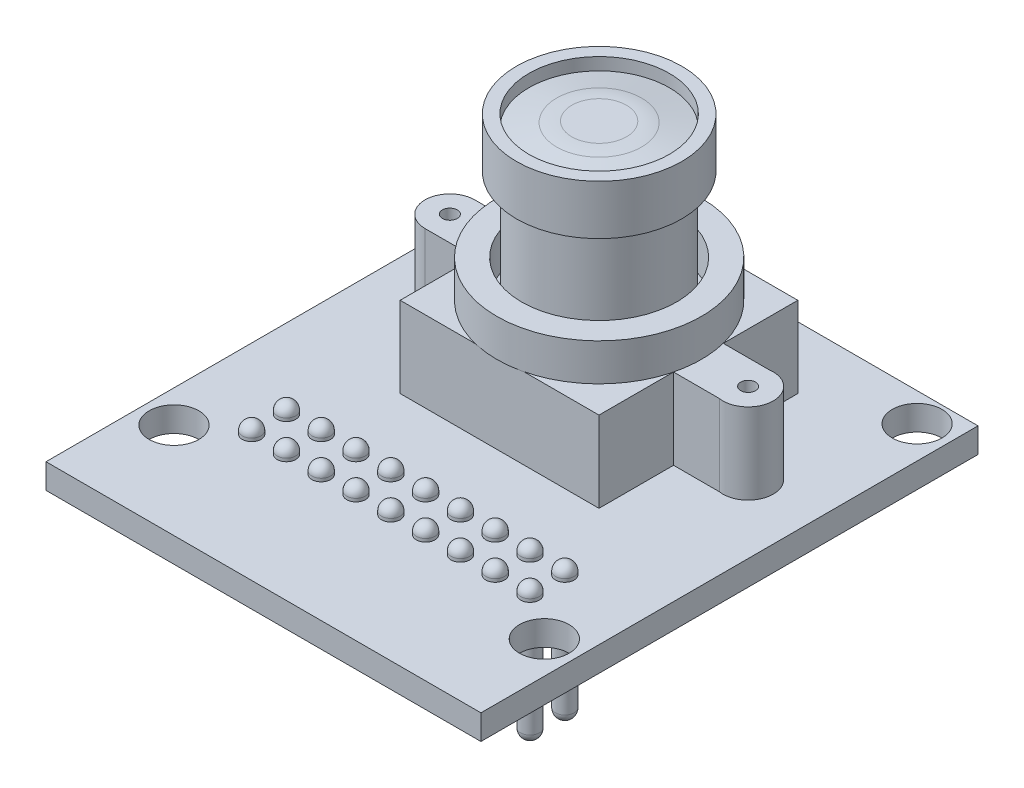
from build123d import *

# Parameters (mm, degrees)
BOARD_W                  = 35
BOARD_H                  = 40
BASEBOARD_DEPTH          = 2
SKETCH2_R                = 2
SCREW_HOLES_DEPTH        = 2
PINS_DEPTH               = 1
PINS_DEPTH_BACK          = 10
SKETCH3_R                = 0.75
FILLET1_R                = 0.75
SKETCH4_R                = 0.6
BOSS_EXTRUDE3_DEPTH      = 6.5
SKETCH5_R                = 8.234207434
SKETCH5_R_2              = 6.234207434
BOSS_EXTRUDE4_DEPTH      = 3
BOSS_EXTRUDE5_DEPTH      = 6
BOSS_EXTRUDE5_DEPTH_BACK = 3
SKETCH6_R                = 5.604867307
SKETCH6_R_2              = 4.804867307
SKETCH7_R                = 6.65
SKETCH7_R_2              = 5.65
BOSS_EXTRUDE6_DEPTH      = 4
SKETCH9_R                = 5.65
GLASS_DEPTH              = 0.5
GLASS_TAPER              = 80
FILLET2_R                = 7


with BuildPart() as part:
    # Board → BaseBoard (new body)
    with BuildSketch(Plane(origin=(0, 0, 0), x_dir=(1, 0, 0), z_dir=(0, 1, 0))):
        Rectangle(BOARD_W, BOARD_H)
    extrude(amount=BASEBOARD_DEPTH)

    # Sketch2 → Screw Holes (cut)
    with BuildSketch(Plane(origin=(0, 2, 0), x_dir=(1, 0, 0), z_dir=(0, 1, 0))):
        with Locations(Location((14.9, 17.7, 0), (0, 0, 270))):
            Circle(SKETCH2_R)
        with Locations(Location((14.9, -12.3, 0), (0, 0, 270))):
            Circle(SKETCH2_R)
        with Locations(Location((-14.9, -12.3, 0), (0, 0, 90))):
            Circle(SKETCH2_R)
        with Locations(Location((-14.9, 17.7, 0), (0, 0, 90))):
            Circle(SKETCH2_R)
    extrude(amount=-SCREW_HOLES_DEPTH, mode=Mode.SUBTRACT)

    # Sketch3 → Pins (add, two sides: drawn at the far end of the back side and taken through both)
    with BuildSketch(Plane(origin=(0, 2, 0), x_dir=(1, 0, 0), z_dir=(0, 1, 0)).offset(-PINS_DEPTH_BACK)):
        with Locations(Location((-11.15, -7, 0), (0, 0, 270))):
            Circle(SKETCH3_R)
        with Locations(Location((-8.35, -7, 0), (0, 0, 270))):
            Circle(SKETCH3_R)
        with Locations(Location((-5.55, -7, 0), (0, 0, 270))):
            Circle(SKETCH3_R)
        with Locations(Location((-2.75, -7, 0), (0, 0, 270))):
            Circle(SKETCH3_R)
        with Locations(Location((0.05, -7, 0), (0, 0, 270))):
            Circle(SKETCH3_R)
        with Locations(Location((2.85, -7, 0), (0, 0, 270))):
            Circle(SKETCH3_R)
        with Locations(Location((5.65, -7, 0), (0, 0, 270))):
            Circle(SKETCH3_R)
        with Locations(Location((8.45, -7, 0), (0, 0, 270))):
            Circle(SKETCH3_R)
        with Locations(Location((11.25, -7, 0), (0, 0, 270))):
            Circle(SKETCH3_R)
        with Locations(Location((-8.35, -9.8, 0), (0, 0, 270))):
            Circle(SKETCH3_R)
        with Locations(Location((-5.55, -9.8, 0), (0, 0, 270))):
            Circle(SKETCH3_R)
        with Locations(Location((-2.75, -9.8, 0), (0, 0, 270))):
            Circle(SKETCH3_R)
        with Locations(Location((0.05, -9.8, 0), (0, 0, 270))):
            Circle(SKETCH3_R)
        with Locations(Location((2.85, -9.8, 0), (0, 0, 270))):
            Circle(SKETCH3_R)
        with Locations(Location((5.65, -9.8, 0), (0, 0, 270))):
            Circle(SKETCH3_R)
        with Locations(Location((8.45, -9.8, 0), (0, 0, 270))):
            Circle(SKETCH3_R)
        with Locations(Location((11.25, -9.8, 0), (0, 0, 270))):
            Circle(SKETCH3_R)
        with Locations(Location((-11.15, -9.8, 0), (0, 0, 270))):
            Circle(SKETCH3_R)
    extrude(amount=PINS_DEPTH + PINS_DEPTH_BACK)

    # Fillet1
    fillet1_edges = [part.edges().sort_by_distance(p)[0] for p in [
        (2.85, -8, 9.05),
        (2.85, 3, 9.05),
        (5.65, -8, 9.05),
        (5.65, 3, 9.05),
        (8.45, -8, 9.05),
        (8.45, 3, 9.05),
        (11.25, -8, 9.05),
        (11.25, 3, 9.05),
        (-11.15, -8, 9.05),
        (-11.15, 3, 9.05),
        (-11.15, -8, 6.25),
        (-11.15, 3, 6.25),
        (-8.35, -8, 6.25),
        (-8.35, 3, 6.25),
        (-5.55, -8, 6.25),
        (-5.55, 3, 6.25),
        (-2.75, -8, 6.25),
        (-2.75, 3, 6.25),
        (0.05, -8, 6.25),
        (0.05, 3, 6.25),
        (2.85, -8, 6.25),
        (2.85, 3, 6.25),
        (5.65, -8, 6.25),
        (5.65, 3, 6.25),
        (8.45, -8, 6.25),
        (8.45, 3, 6.25),
        (11.25, -8, 6.25),
        (11.25, 3, 6.25),
        (-8.35, -8, 9.05),
        (-8.35, 3, 9.05),
        (-5.55, -8, 9.05),
        (-5.55, 3, 9.05),
        (-2.75, -8, 9.05),
        (-2.75, 3, 9.05),
        (0.05, -8, 9.05),
        (0.05, 3, 9.05),
    ]]
    fillet(fillet1_edges, radius=FILLET1_R)


with BuildPart() as body_2:
    # Sketch4 → Boss-Extrude3 (new body)
    with BuildSketch(Plane(origin=(0, 2, 0), x_dir=(1, 0, 0), z_dir=(0, 1, 0))):
        with BuildLine():
            Line((-12, 5), (-8, 5))
            Line((-8, 5), (-8, -1))
            Line((-8, -1), (8, -1))
            Line((8, -1), (8, 5))
            Line((8, 5), (11.684400627, 5))
            ThreePointArc((11.684400627, 5), (14.02474763, 7), (11.684400627, 9))
            Line((11.684400627, 9), (8, 9))
            Line((8, 9), (8, 15))
            Line((8, 15), (-8, 15))
            Line((-8, 15), (-8, 9))
            Line((-8, 9), (-12, 9))
            ThreePointArc((-12, 9), (-14, 7), (-12, 5))
        make_face()
        with Locations(Location((-12, 7, 0), (0, 0, 270))):
            Circle(SKETCH4_R, mode=Mode.SUBTRACT)
        with Locations(Location((12, 7, 0), (0, 0, 270))):
            Circle(SKETCH4_R, mode=Mode.SUBTRACT)
    extrude(amount=BOSS_EXTRUDE3_DEPTH)


with BuildPart() as body_3:
    # Sketch5 → Boss-Extrude4 (new body)
    with BuildSketch(Plane(origin=(0, 8.5, 0), x_dir=(1, 0, 0), z_dir=(0, 1, 0))):
        with Locations(Location((0.012373815, 7, 0), (0, 0, 270))):
            Circle(SKETCH5_R)
        with Locations(Location((0.012373815, 7, 0), (0, 0, 270))):
            Circle(SKETCH5_R_2, mode=Mode.SUBTRACT)
    extrude(amount=BOSS_EXTRUDE4_DEPTH)


with BuildPart() as body_4:
    # Sketch6 → Boss-Extrude5 (new, two sides: drawn at the far end of the back side and taken through both)
    with BuildSketch(Plane(origin=(0, 11.5, 0), x_dir=(1, 0, 0), z_dir=(0, 1, 0)).offset(-BOSS_EXTRUDE5_DEPTH_BACK)):
        with Locations(Location((0.012373815, 7, 0), (0, 0, 270))):
            Circle(SKETCH6_R)
        with Locations(Location((0.012373815, 7, 0), (0, 0, 270))):
            Circle(SKETCH6_R_2, mode=Mode.SUBTRACT)
    extrude(amount=BOSS_EXTRUDE5_DEPTH + BOSS_EXTRUDE5_DEPTH_BACK)


with BuildPart() as body_5:
    # Sketch7 → Boss-Extrude6 (new body)
    with BuildSketch(Plane(origin=(0, 17.5, 0), x_dir=(1, 0, 0), z_dir=(0, 1, 0))):
        with Locations(Location((0.012373815, 7, 0), (0, 0, 270))):
            Circle(SKETCH7_R)
        with Locations(Location((0.012373815, 7, 0), (0, 0, 270))):
            Circle(SKETCH7_R_2, mode=Mode.SUBTRACT)
    extrude(amount=BOSS_EXTRUDE6_DEPTH)


with BuildPart() as body_6:
    # Sketch9 → Glass (new body)
    with BuildSketch(Plane(origin=(0, 20.5, 0), x_dir=(1, 0, 0), z_dir=(0, 1, 0))):
        with Locations(Location((0.012373815, 7, 0), (0, 0, 270))):
            Circle(SKETCH9_R)
    extrude(amount=GLASS_DEPTH, taper=GLASS_TAPER)

    # Fillet2
    fillet2_edges = [body_6.edges().sort_by_distance(p)[0] for p in [
        (0.012373815, 21, -9.81435909),
    ]]
    fillet(fillet2_edges, radius=FILLET2_R)


solid = Compound([part.part, body_2.part, body_3.part, body_4.part, body_5.part, body_6.part])
